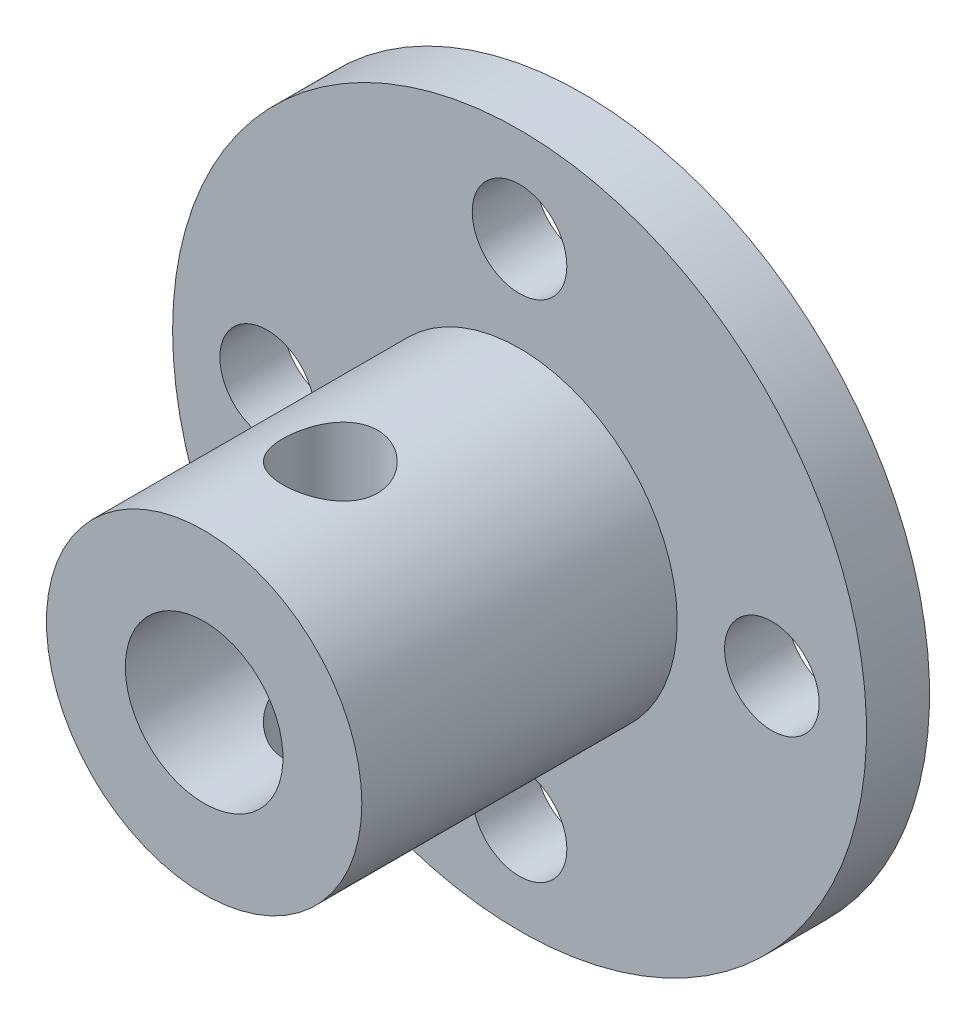
from build123d import *

# Parameters (mm, degrees)
SKETCH1_W                    = 11
SKETCH1_H                    = 2
SKETCH2_R                    = 5
BOSS_EXTRUDE1_DEPTH          = 10
F_3_0_3_DIAMETER_HOLE1_D     = 3
F_3_0_3_DIAMETER_HOLE1_DEPTH = 12
F_5_0_5_DIAMETER_HOLE1_D     = 5
F_3_0_3_DIAMETER_HOLE2_D     = 3
F_3_0_3_DIAMETER_HOLE2_DEPTH = 13


with BuildPart() as part:
    # Sketch1 → Revolve1 (revolve)
    with BuildSketch(Plane.XZ, mode=Mode.PRIVATE) as revolve1_sk:
        with Locations((5.5, 1)):
            Rectangle(SKETCH1_W, SKETCH1_H)
    revolve(revolve1_sk.sketch.rotate(Axis((0, 0, 2), (0, 0, -1)), 180), axis=Axis((0, 0, 2), (0, 0, -1)))

    # Sketch2 → Boss-Extrude1 (add)
    with BuildSketch(Plane.XY.offset(2)):
        Circle(SKETCH2_R)
    extrude(amount=BOSS_EXTRUDE1_DEPTH)

    # Ø3.0 (3) Diameter Hole1
    with Locations(Plane(origin=(0, 0, 0), x_dir=(-1, 0, 0), z_dir=(0, 0, -1))):
        with Locations((0, 8), (-8, 0), (0, -8), (8, 0)):
            Hole(F_3_0_3_DIAMETER_HOLE1_D / 2, depth=F_3_0_3_DIAMETER_HOLE1_DEPTH)

    # Ø5.0 (5) Diameter Hole1 (through all)
    with Locations(Plane(origin=(0, 0, 0), x_dir=(-1, 0, 0), z_dir=(0, 0, -1))):
        with Locations((0, 0)):
            Hole(F_5_0_5_DIAMETER_HOLE1_D / 2)

    # Ø3.0 (3) Diameter Hole2
    with Locations(Plane(origin=(0, 5, 8), x_dir=(1, 0, 0), z_dir=(0, 1, 0))):
        with Locations((0, 0)):
            Hole(F_3_0_3_DIAMETER_HOLE2_D / 2, depth=F_3_0_3_DIAMETER_HOLE2_DEPTH)


solid = part.part
